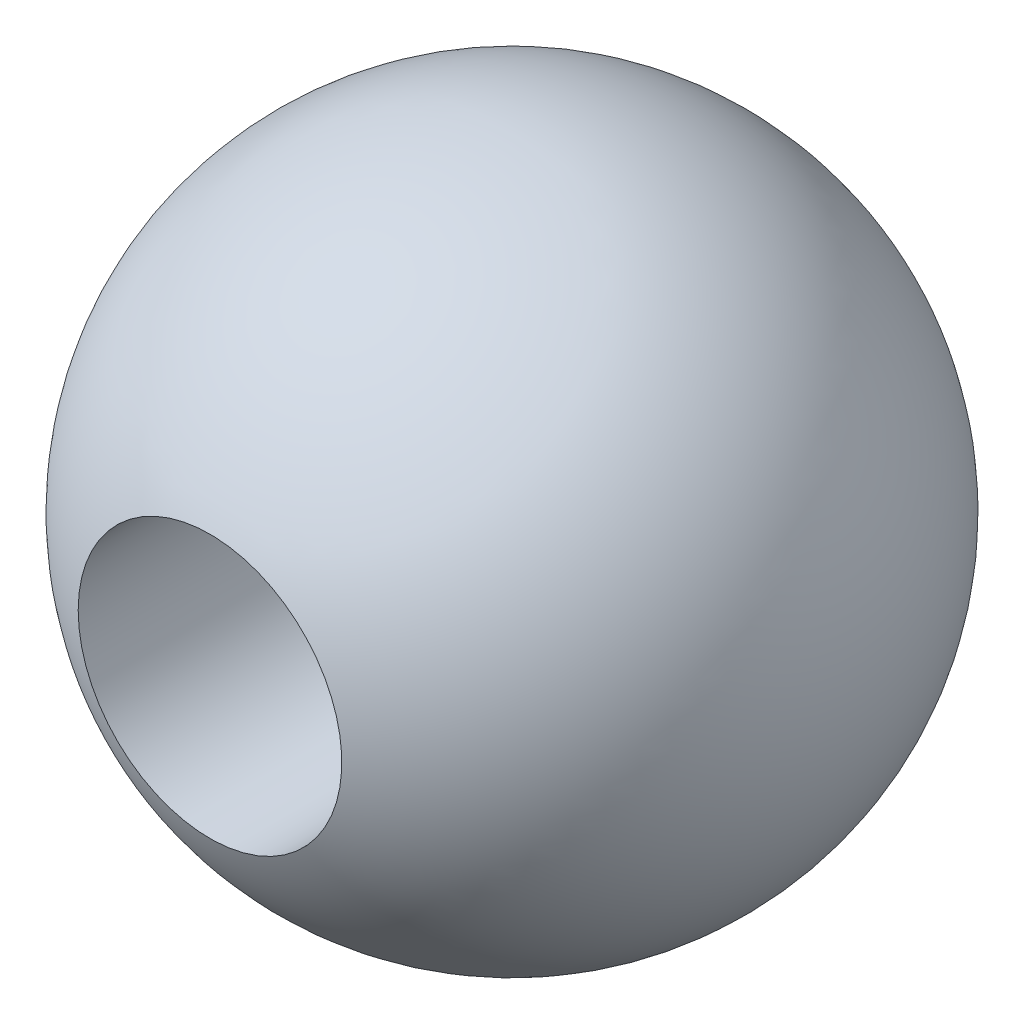
from build123d import *

# Parameters (mm, degrees)
CUT_EXTRUDE1_DEPTH      = 11.998522628
CUT_EXTRUDE1_DEPTH_BACK = 11.998522628
SKETCH2_R               = 2.54


with BuildPart() as part:
    # Sketch1 → Revolve1 (revolve)
    with BuildSketch(Plane.XY):
        with BuildLine():
            Line((0, 6.35), (0, -6.35))
            ThreePointArc((0, -6.35), (6.35, 0), (0, 6.35))
        make_face()
    revolve(axis=Axis((0, 6.35, 0), (0, -1, 0)))

    # Sketch2 → Cut-Extrude1 (cut, two sides: drawn at the far end of the back side and taken through both)
    with BuildSketch(Plane.XY.offset(-CUT_EXTRUDE1_DEPTH_BACK)):
        with Locations(Location((0, 0, 0), (0, 0, 180))):
            Circle(SKETCH2_R)
    extrude(amount=CUT_EXTRUDE1_DEPTH + CUT_EXTRUDE1_DEPTH_BACK, mode=Mode.SUBTRACT)


solid = part.part
